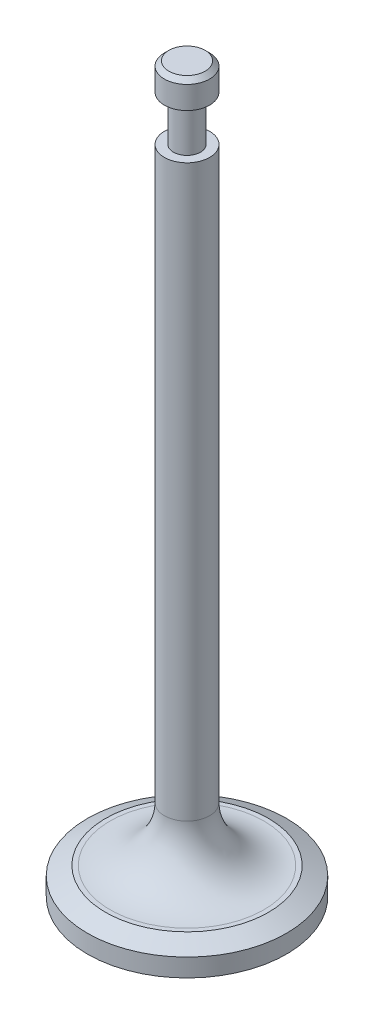
from build123d import *

# Parameters (mm, degrees)
FILLET1_R      = 6
CHAMFER1_SIZE  = 1
CHAMFER1_SIZE2 = 2
CHAMFER2_SIZE  = 0.5


with BuildPart() as part:
    # Sketch1 → Revolve1 (revolve)
    with BuildSketch(Plane(origin=(0, 0, 0), x_dir=(0, 0, -1), z_dir=(1, 0, 0)), mode=Mode.PRIVATE) as revolve1_sk:
        Polygon((0, 0), (0, -80), (11, -80), (11, -77), (2.5, -77), (2.5, -8), (1.5, -8), (1.5, -3), (2.5, -3), (2.5, 0), align=None)
    revolve(revolve1_sk.sketch.rotate(Axis((0, 0, 0), (0, -1, 0)), 180), axis=Axis((0, 0, 0), (0, -1, 0)))

    # Fillet1
    fillet1_edges = [part.edges().sort_by_distance(p)[0] for p in [
        (0, -77, -2.5),
    ]]
    fillet(fillet1_edges, radius=FILLET1_R)

    # Chamfer1
    chamfer1_edges = [part.edges().sort_by_distance(p)[0] for p in [
        (0, -77, -11),
    ]]
    chamfer1_side = [part.faces().sort_by_distance(p)[0] for p in [
        (0, -78.5, -11),
    ]]
    chamfer(chamfer1_edges, length=CHAMFER1_SIZE, length2=CHAMFER1_SIZE2, reference=chamfer1_side[0])

    # Chamfer2
    chamfer2_edges = [part.edges().sort_by_distance(p)[0] for p in [
        (0, 0, -2.5),
    ]]
    chamfer(chamfer2_edges, length=CHAMFER2_SIZE)


solid = part.part
